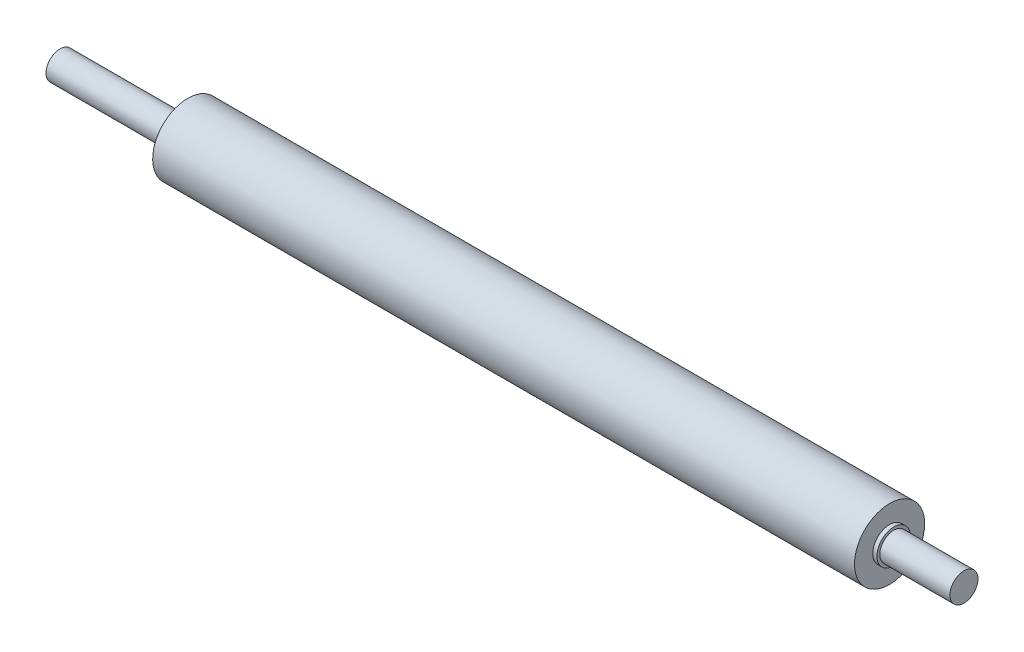
from build123d import *

# Parameters (mm, degrees)
SKETCH_1_W      = 494
SKETCH_1_H      = 10
SKETCH_2_R      = 10
EXTRUDE_1_DEPTH = 76


with BuildPart() as part:
    # 草图1 → 旋转1 (revolve)
    with BuildSketch(Plane.XY):
        Polygon((-265, 0), (-265, 10), (-253, 10), (-253, 12), (-250, 12), (-250, 25), (250, 25), (250, 12), (253, 12), (253, 10), (303, 10), (303, 0), align=None)
        with Locations((0, 17)):
            Rectangle(SKETCH_1_W, SKETCH_1_H, mode=Mode.SUBTRACT)
    revolve(axis=Axis((303, 0, 0), (-1, 0, 0)))

    # 草图2 → 凸台-拉伸1 (add)
    with BuildSketch(Plane.ZY.offset(265)):
        with Locations(Location((0, 0, 0), (0, 0, 90))):
            Circle(SKETCH_2_R)
    extrude(amount=EXTRUDE_1_DEPTH)


solid = part.part
